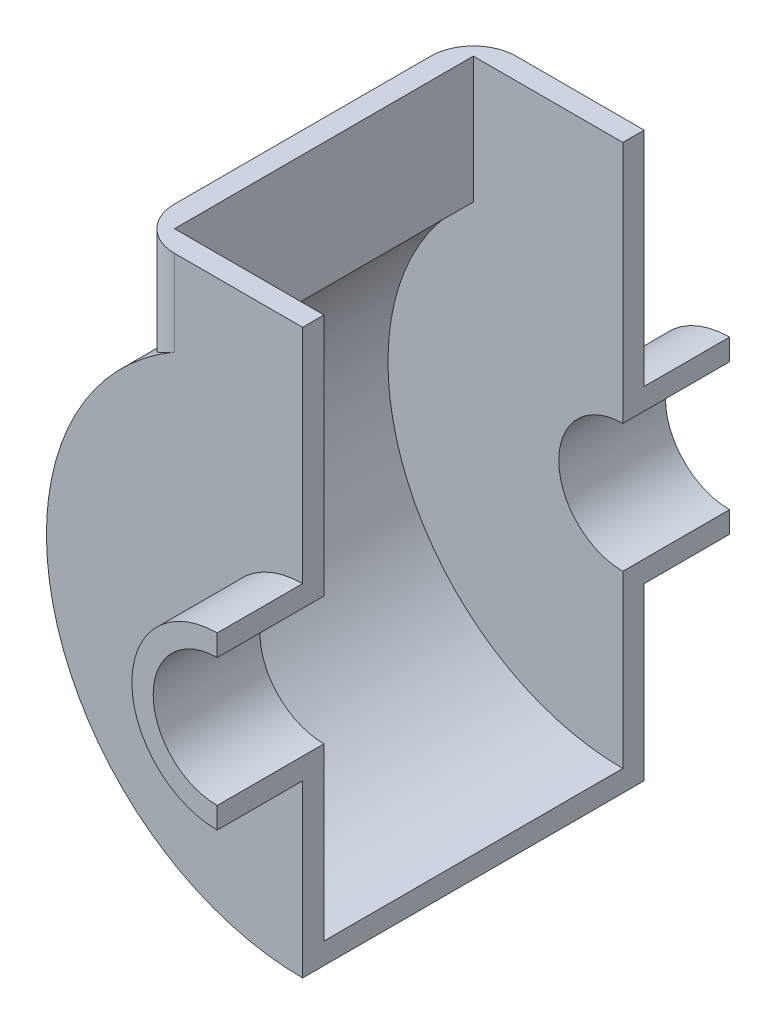
from build123d import *

# Parameters (mm, degrees)
DODANIE_WYCI_GNI_CIE1_DEPTH       = 25
DODANIE_WYCI_GNI_CIE2_DEPTH       = 5
WYCI_GNI_CIE_CIENKA_CIANKA3_REACH = 135.45
ZAOKR_GLENIE1_R                   = 10
ZAOKR_GLENIE2_R                   = 10


with BuildPart() as part:
    # Szkic1 → Dodanie-wyciągnięcie1 (new body)
    with BuildSketch(Plane.XY):
        with BuildLine():
            Line((0, 15), (0, 20))
            ThreePointArc((0, 20), (-20, 0), (0, -20))
            Line((0, -20), (0, -15))
            ThreePointArc((0, -15), (-15, 0), (0, 15))
        make_face()
    extrude(amount=DODANIE_WYCI_GNI_CIE1_DEPTH)

    # Szkic2 → Dodanie-wyciągnięcie2 (add)
    with BuildSketch(Plane.XY):
        with BuildLine():
            Line((0, 20), (0, 72))
            Line((0, 72), (-40, 72))
            Line((-40, 72), (-40, 44.72135955))
            ThreePointArc((-40, 44.72135955), (-56.050341538, -21.409325386), (0, -60))
            Line((0, -60), (0, -20))
            Line((0, -20), (0, -15))
            ThreePointArc((0, -15), (-15, 0), (0, 15))
            Line((0, 15), (0, 20))
        make_face()
    extrude(amount=DODANIE_WYCI_GNI_CIE2_DEPTH)


with BuildPart() as body_2:
    # Lustro10: mirrored copy
    add(part.part.mirror(Plane.XY.offset(-35)))

    # Szkic3 → Wyciągnięcie-cienka ścianka3 (add, up to next)
    with BuildSketch(Plane.XY, mode=Mode.PRIVATE) as wyci_gni_cie_cienka_cianka3_sk1:
        with BuildLine():
            Line((-40, 72), (-40, 44.72135955))
            ThreePointArc((-40, 44.72135955), (-56.050341538, -21.409325386), (0, -60))
            Line((0, -60), (0, -55))
            ThreePointArc((0, -55), (-51.76124215, -18.594994247), (-35, 42.426406871))
            Line((-35, 42.426406871), (-35, 72))
            Line((-35, 72), (-40, 72))
        make_face()
    wyci_gni_cie_cienka_cianka3_tool1 = extrude(wyci_gni_cie_cienka_cianka3_sk1.sketch, amount=-WYCI_GNI_CIE_CIENKA_CIANKA3_REACH, mode=Mode.PRIVATE) - body_2.part

    add(part.part)  # Wyciągnięcie-cienka ścianka3 merges part
    add(wyci_gni_cie_cienka_cianka3_tool1.solids().sort_by_distance((-36.449966, 57.213203, 0))[0])

    # Zaokrąglenie1
    zaokr_glenie1_edges = [body_2.edges().sort_by_distance(p)[0] for p in [
        (-40, 58.360679775, 5),
    ]]
    fillet(zaokr_glenie1_edges, radius=ZAOKR_GLENIE1_R)

    # Zaokrąglenie2
    zaokr_glenie2_edges = [body_2.edges().sort_by_distance(p)[0] for p in [
        (-40, 58.360679775, -75),
    ]]
    fillet(zaokr_glenie2_edges, radius=ZAOKR_GLENIE2_R)


solid = body_2.part
